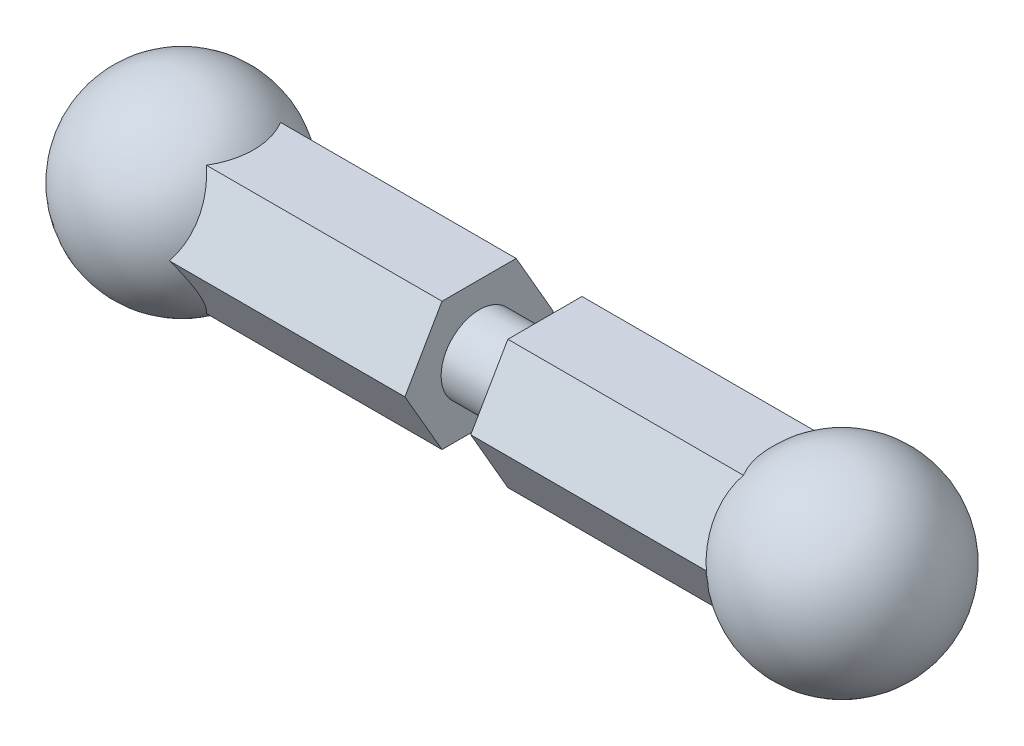
from build123d import *

# Parameters (mm, degrees)
BOSS_EXTRUDE2_DEPTH = 9.25
SKETCH5_R           = 1.190625
BOSS_EXTRUDE3_DEPTH = 2.05


with BuildPart() as part:
    # Sketch2 → Revolve1 (revolve)
    with BuildSketch(Plane.XY):
        with BuildLine():
            Line((0, 3), (0, -3))
            ThreePointArc((0, -3), (3, 0), (0, 3))
        make_face()
    revolve(axis=Axis((0, 3, 0), (0, -1, 0)))

    # Sketch3 → Boss-Extrude2 (add)
    with BuildSketch(Plane(origin=(0, 0, 0), x_dir=(0, 0, -1), z_dir=(1, 0, 0))):
        Polygon((1.154700538, -2), (2.309401077, 0), (1.154700538, 2), (-1.154700538, 2), (-2.309401077, 0), (-1.154700538, -2), align=None)
    boss_extrude2 = extrude(amount=BOSS_EXTRUDE2_DEPTH)

    # Sketch5 → Boss-Extrude3 (add)
    with BuildSketch(Plane(origin=(9.25, 0, 0), x_dir=(0, 0, -1), z_dir=(1, 0, 0))):
        with Locations(Location((0.007936131, 0, 0), (0, 0, 180))):
            Circle(SKETCH5_R)
    extrude(amount=BOSS_EXTRUDE3_DEPTH)


with BuildPart() as body_2:
    # Sketch7 → Revolve2 (revolve)
    with BuildSketch(Plane(origin=(20.55, 0, 0), x_dir=(0, 0, -1), z_dir=(1, 0, 0))):
        with BuildLine():
            ThreePointArc((0, 3), (3, 0), (0, -3))
            Line((0, -3), (0, 3))
        make_face()
    revolve(axis=Axis((20.55, 3, 0), (0, -1, 0)))

    # Mirror3: Boss-Extrude2 across plane
    add(boss_extrude2.mirror(Plane(origin=(10.275, 0, 0), x_dir=(0, 0, 1), z_dir=(1, 0, 0))))


solid = Compound([part.part, body_2.part])
